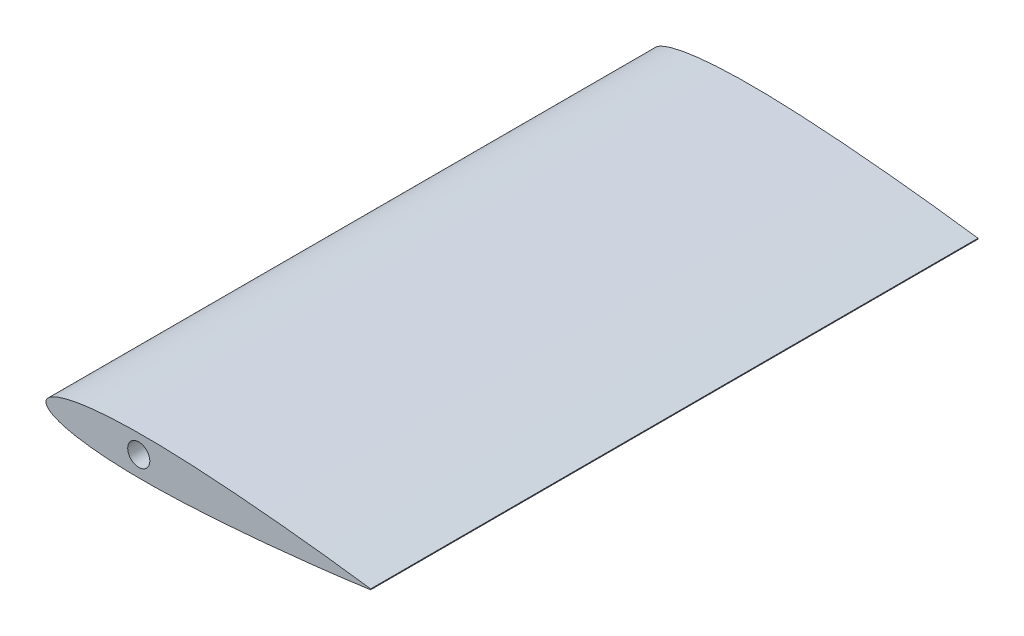
from build123d import *

# Parameters (mm, degrees)
BOSS_EXTRUDE4_DEPTH = 55
SKETCH8_R           = 1
CUT_EXTRUDE3_DEPTH  = 62.926702671


with BuildPart() as part:
    # Sketch7 → Boss-Extrude4 (new body)
    with BuildSketch(Plane.XY):
        with BuildLine():
            Line((1, -0.10458), (1, -0.030492))
            add(Edge.make_bspline(
                [(1, -0.030492), (0.4391072, 0.048291643), (-1.674403185, 0.334004631), (-4.617530754, 0.684240443), (-8.132656486, 1.046660581), (-10.797969598, 1.284679919), (-13.346212552, 1.471490986), (-15.458523396, 1.594302147), (-17.534124999, 1.675667087), (-19.529591939, 1.706588124), (-21.218108073, 1.682770802), (-22.598496265, 1.62014828), (-23.68140911, 1.53967512), (-24.671353768, 1.432175628), (-25.432681359, 1.318284621), (-25.987666395, 1.213155291), (-26.36247535, 1.13107875), (-26.707765564, 1.043628683), (-27.022774053, 0.951196852), (-27.306806225, 0.854090221), (-27.559256366, 0.752644178), (-27.779624738, 0.647151373), (-27.967491511, 0.537831437), (-28.122637923, 0.424869691), (-28.244764188, 0.308080317), (-28.333575795, 0.187132471), (-28.387875352, 0.061434974), (-28.405910061, -0.067536), (-28.387875352, -0.196506974), (-28.333575795, -0.322204471), (-28.244764188, -0.443152317), (-28.122637923, -0.559941691), (-27.967491511, -0.672903437), (-27.779624738, -0.782223373), (-27.559256366, -0.887716178), (-27.306806225, -0.989162221), (-27.022774053, -1.086268852), (-26.707765564, -1.178700683), (-26.36247535, -1.26615075), (-25.845317635, -1.379399155), (-25.128587685, -1.503940817), (-24.18858799, -1.624259365), (-22.953504403, -1.736332976), (-21.40315583, -1.815152516), (-19.299544677, -1.84491037), (-17.068129243, -1.798767021), (-14.756327199, -1.692559872), (-12.641605147, -1.558113836), (-10.329512475, -1.378613782), (-8.303516398, -1.19440739), (-5.692375718, -0.932615266), (-3.109793095, -0.64378772), (-0.644324126, -0.330601026), (0.586969476, -0.162396474), (0.948583439, -0.111802029), (1, -0.10458)],
                knots=[0, 0, 0, 0, 0.028342901, 0.106722049, 0.148306055, 0.205171367, 0.2406214, 0.276160573, 0.311047092, 0.344559266, 0.37601757, 0.395537659, 0.413698812, 0.430349273, 0.445356904, 0.452209372, 0.458611567, 0.464554044, 0.47002985, 0.475034902, 0.479569141, 0.483636857, 0.487250263, 0.490431338, 0.493218828, 0.495674086, 0.497891368, 0.5, 0.502108632, 0.504325914, 0.506781172, 0.509568662, 0.512749737, 0.516363143, 0.520430859, 0.524965098, 0.52997015, 0.535445956, 0.541388433, 0.547790628, 0.561933981, 0.577778559, 0.595202024, 0.62398243, 0.655440734, 0.700464146, 0.735649713, 0.771241831, 0.806495957, 0.851693945, 0.873039495, 0.937813387, 0.981728388, 0.997401831, 1, 1, 1, 1], degree=3))
        make_face()
    extrude(amount=BOSS_EXTRUDE4_DEPTH)

    # Sketch8 → Cut-Extrude3 (cut, through all)
    with BuildSketch(Plane.XY.offset(55)):
        with Locations((-20, 0)):
            Circle(SKETCH8_R)
    extrude(amount=-CUT_EXTRUDE3_DEPTH, mode=Mode.SUBTRACT)


solid = part.part
